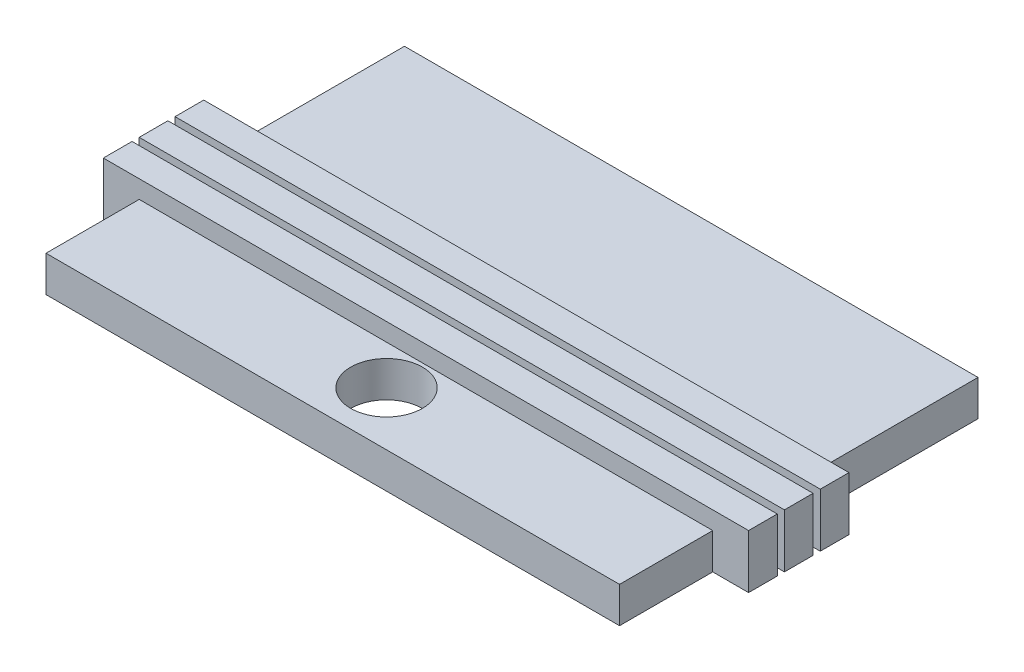
from build123d import *

# Parameters (mm, degrees)
SKETCH1_W           = 80
SKETCH1_H           = 50
BOSS_EXTRUDE1_DEPTH = 5
SKETCH1_3_W         = 90
SKETCH1_3_H         = 4
BOSS_EXTRUDE2_DEPTH = 7.5
SKETCH1_4_R         = 5
CUT_EXTRUDE1_DEPTH  = 5


with BuildPart() as part:
    # Sketch1 → Boss-Extrude1 (new body)
    with BuildSketch(Plane(origin=(0, 0, 0), x_dir=(1, 0, 0), z_dir=(0, 1, 0))):
        Rectangle(SKETCH1_W, SKETCH1_H)
    extrude(amount=BOSS_EXTRUDE1_DEPTH)

    # Sketch1<3> → Boss-Extrude2 (add)
    with BuildSketch(Plane(origin=(0, 0, 0), x_dir=(1, 0, 0), z_dir=(0, 1, 0))):
        Rectangle(SKETCH1_3_W, SKETCH1_3_H)
        with Locations((0, -5)):
            Rectangle(SKETCH1_3_W, SKETCH1_3_H)
        with Locations((0, -10)):
            Rectangle(SKETCH1_3_W, SKETCH1_3_H)
    extrude(amount=BOSS_EXTRUDE2_DEPTH)

    # Sketch1<4> → Cut-Extrude1 (cut)
    with BuildSketch(Plane(origin=(0, 0, 0), x_dir=(1, 0, 0), z_dir=(0, 1, 0))):
        with Locations(Location((0, -17.5, 0), (0, 0, 90))):
            Circle(SKETCH1_4_R)
    extrude(amount=CUT_EXTRUDE1_DEPTH, mode=Mode.SUBTRACT)


solid = part.part
